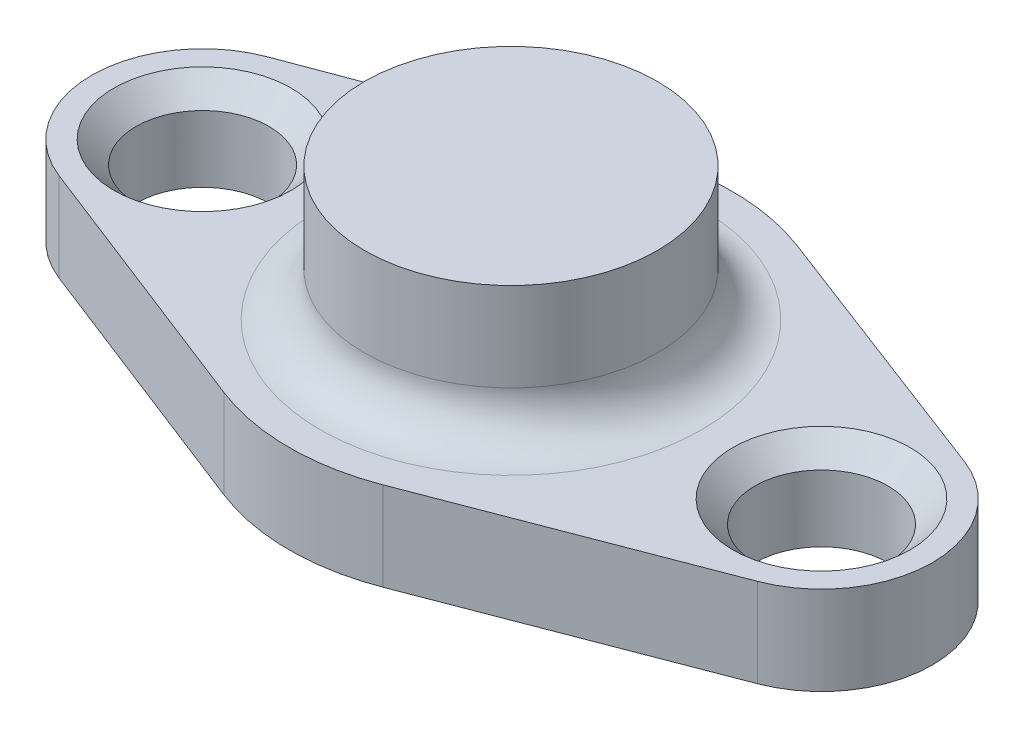
from build123d import *

# Parameters (mm, degrees)
EXTRUDE_316_DEPTH   = 20
SKETCH_2_R          = 33.033320501
EXTRUDE_1_DEPTH     = 30
SKETCH_3_R          = 15
CUT_EXTRUDE_1_DEPTH = 112.46747736
FILLET_1_R          = 10
CHAMFER_1_SIZE      = 5


with BuildPart() as part:
    # Эскиз1 → Extrude 316 (new body)
    with BuildSketch(Plane(origin=(0, 0, 0), x_dir=(-1, 0, 0), z_dir=(0, -1, 0))):
        with BuildLine():
            Line((-78.917505692, 23.388614652), (-17.835027079, 46.710938859))
            ThreePointArc((-17.835027079, 46.710938859), (-0.148812417, 49.999778548), (17.556665634, 46.816273793))
            Line((17.556665634, 46.816273793), (78.776887546, 23.857954408))
            ThreePointArc((78.776887546, 23.857954408), (94.998038561, 0.610466623), (79.076996078, -22.84357002))
            Line((79.076996078, -22.84357002), (18.156882698, -46.586775062))
            ThreePointArc((18.156882698, -46.586775062), (0.148812417, -49.999778548), (-17.879254632, -46.694028031))
            Line((-17.879254632, -46.694028031), (-78.939619469, -23.313868793))
            ThreePointArc((-78.939619469, -23.313868793), (-94.99998935, 0.044982802), (-78.917505692, 23.388614652))
        make_face()
    extrude(amount=EXTRUDE_316_DEPTH)

    # Эскиз2 → Бобышка-Вытянуть1 (add)
    with BuildSketch(Plane(origin=(0, 0, 0), x_dir=(-1, 0, 0), z_dir=(0, 1, 0))):
        with Locations(Location((0, 0, 0), (0, 0, 180))):
            Circle(SKETCH_2_R)
    extrude(amount=EXTRUDE_1_DEPTH)

    # Эскиз3 → Вырез-Вытянуть1 (cut, through all)
    with BuildSketch(Plane(origin=(0, 0, 0), x_dir=(-1, 0, 0), z_dir=(0, 1, 0))):
        with Locations((-69.999992153, -0.033145222)):
            Circle(SKETCH_3_R)
        with Locations((69.998554729, -0.449817511)):
            Circle(SKETCH_3_R)
    extrude(amount=-CUT_EXTRUDE_1_DEPTH, mode=Mode.SUBTRACT)

    # Скругление1
    fillet_1_edges = [part.edges().sort_by_distance(p)[0] for p in [
        (-33.033320501, 0, 0),
    ]]
    fillet(fillet_1_edges, radius=FILLET_1_R)

    # Фаска1
    chamfer_1_edges = [part.edges().sort_by_distance(p)[0] for p in [
        (84.999992153, 0, -0.033145222),
        (-54.998554729, 0, -0.449817511),
    ]]
    chamfer(chamfer_1_edges, length=CHAMFER_1_SIZE)


solid = part.part
